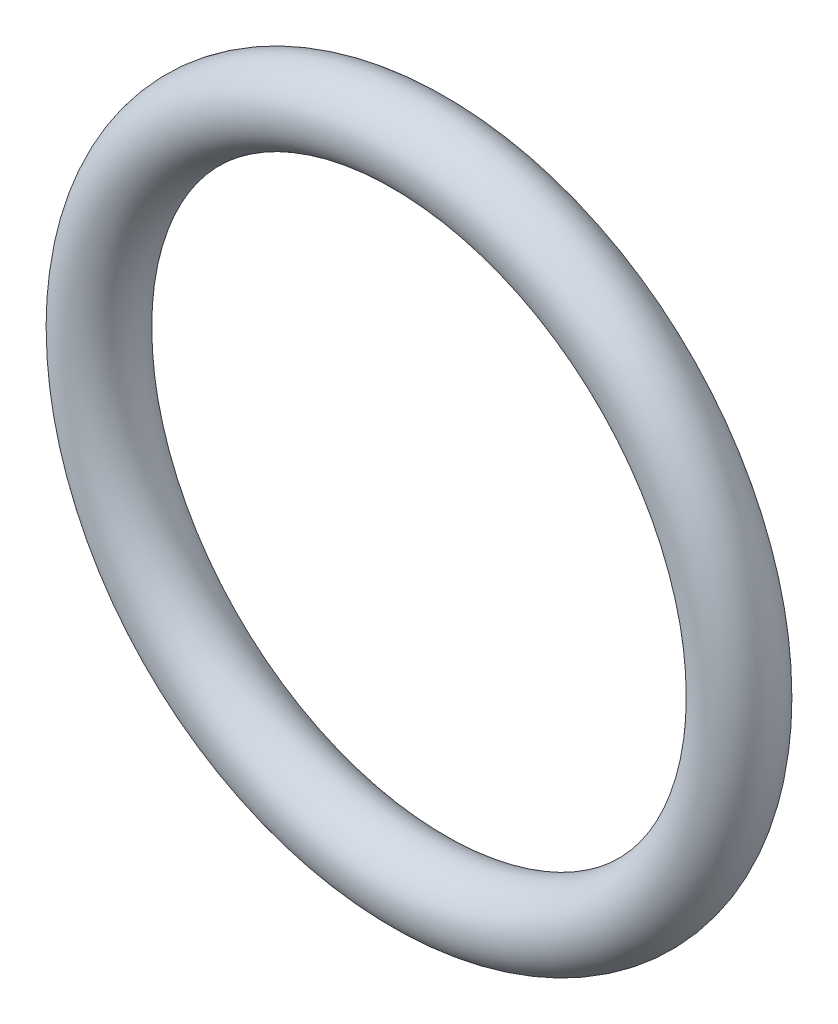
from build123d import *

# Parameters (mm, degrees)
SKETCH3_R = 1.725


with BuildPart() as part:
    # Sketch3 → Revolve1 (revolve)
    with BuildSketch(Plane(origin=(0, 0, 0), x_dir=(0, 0, -1), z_dir=(1, 0, 0)), mode=Mode.PRIVATE) as revolve1_sk:
        with Locations((0, 14.775)):
            Circle(SKETCH3_R)
    revolve(revolve1_sk.sketch.rotate(Axis((0, 0, 1.06515357), (0, 0, -1)), 90), axis=Axis((0, 0, 1.06515357), (0, 0, -1)))


solid = part.part
